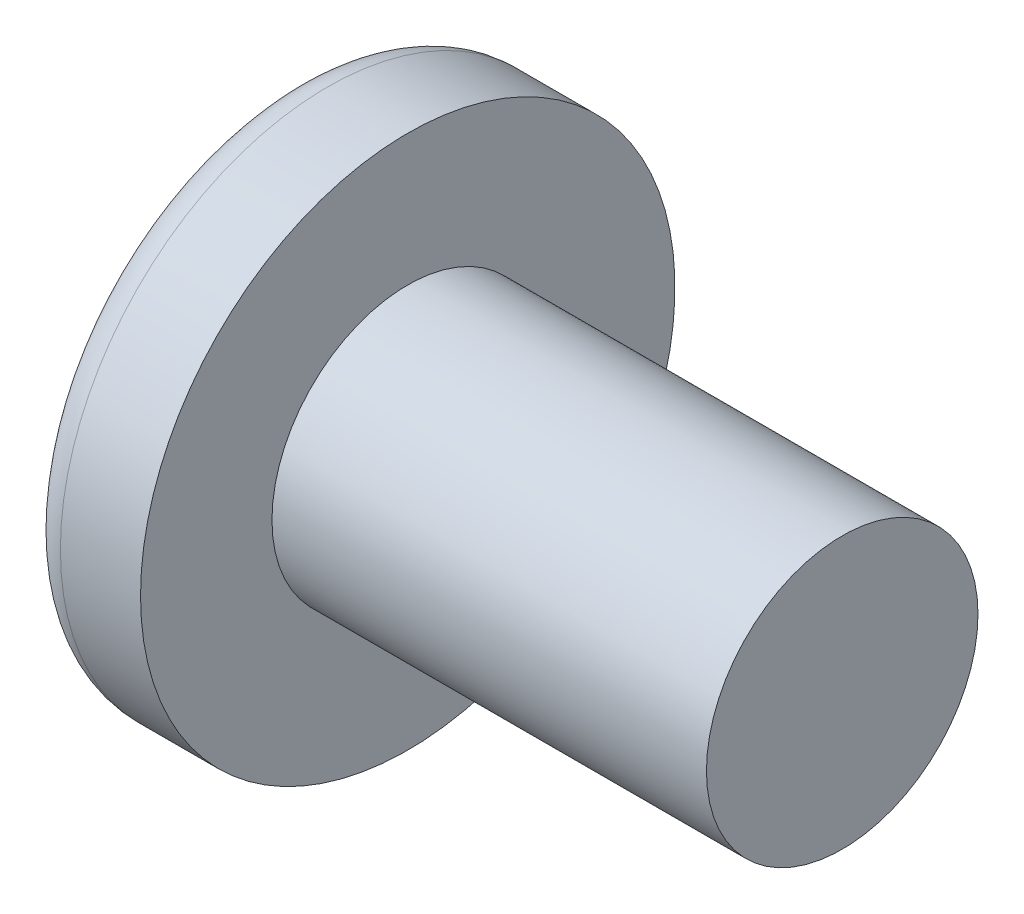
from build123d import *

# Parameters (mm, degrees)
CIRPATTERN1_COUNT = 2
CIRPATTERN1_ANGLE = 90


with BuildPart() as part:
    # BodySke → Base-Revolve (revolve)
    with BuildSketch(Plane.XY, mode=Mode.PRIVATE) as base_revolve_sk:
        with BuildLine():
            Line((5.5372, 3.96875), (5.5372, 7.8105))
            Line((5.5372, 7.8105), (3.194705383, 7.8105))
            ThreePointArc((3.194705383, 7.8105), (2.729959918, 7.697975319), (2.368158025, 7.385326087))
            ThreePointArc((2.368158025, 7.385326087), (0.606522562, 3.877860681), (0, 0))
            Line((0, 0), (18.2372, 0))
            Line((18.2372, 0), (18.2372, 3.96875))
            Line((18.2372, 3.96875), (5.5372, 3.96875))
        make_face()
    revolve(base_revolve_sk.sketch.rotate(Axis((-25.4, 0, 0), (1, 0, 0)), 90), axis=Axis((-25.4, 0, 0), (1, 0, 0)))

    # Sketch3 → Cut-Loft1 section 0
    with BuildSketch(Plane(origin=(0, 0, 0), x_dir=(0, 0, -1), z_dir=(1, 0, 0))):
        with BuildLine():
            Line((0.8763, -5.0292), (-0.8763, -5.0292))
            Line((-0.8763, -5.0292), (-0.8763, 5.0292))
            Line((-0.8763, 5.0292), (0.8763, 5.0292))
            Line((0.8763, 5.0292), (0.8763, -5.0292))
        make_face()
    # Sketch4 → Cut-Loft1 section 1
    with BuildSketch(Plane(origin=(5.8674, 0, 0), x_dir=(0, 0, -1), z_dir=(1, 0, 0))):
        with BuildLine():
            Line((0.43815, -0.43815), (-0.43815, -0.43815))
            Line((-0.43815, -0.43815), (-0.43815, 0.43815))
            Line((-0.43815, 0.43815), (0.43815, 0.43815))
            Line((0.43815, 0.43815), (0.43815, -0.43815))
        make_face()
    cut_loft1 = loft(mode=Mode.SUBTRACT)

    # CirPattern1: Cut-Loft1 ×2 about axis
    cirpattern1_axis = Axis((0, 0, 0), (1, 0, 0))
    for i in range(1, CIRPATTERN1_COUNT):
        add(cut_loft1.rotate(cirpattern1_axis, i * CIRPATTERN1_ANGLE / (CIRPATTERN1_COUNT - 1)), mode=Mode.SUBTRACT)


solid = part.part
